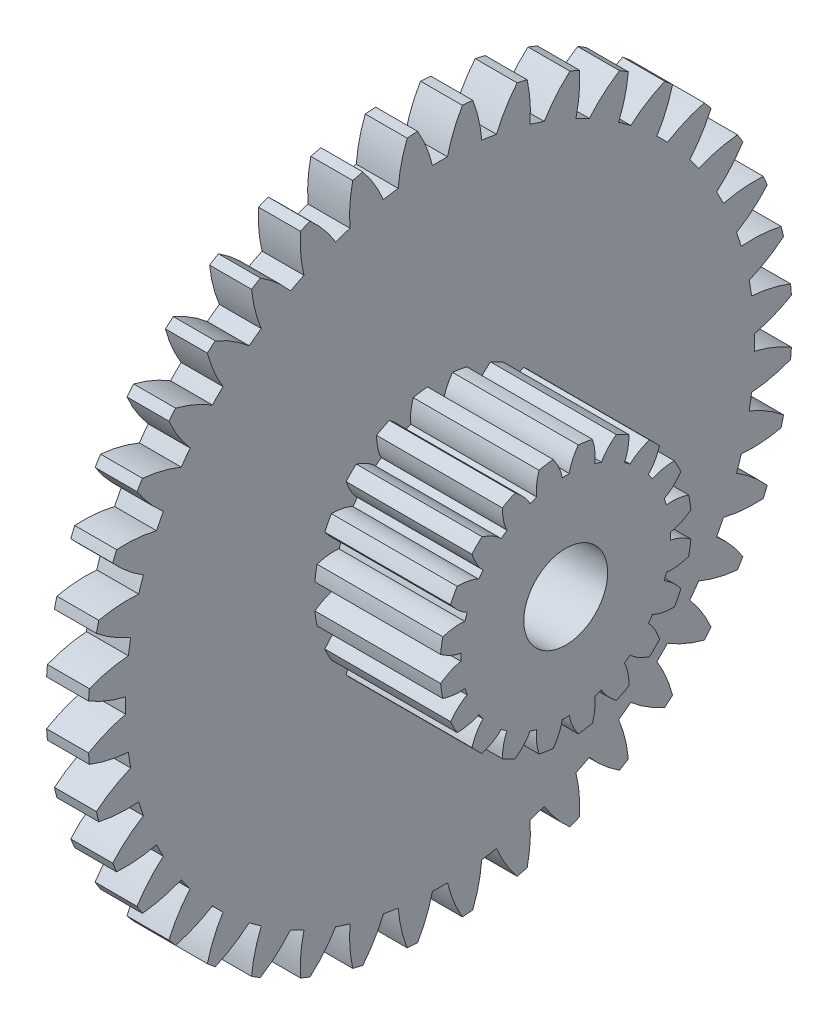
from build123d import *

# Parameters (mm, degrees)
BASPROSKE_W                  = 1
BASPROSKE_H                  = 8.4
TOOTHCUT_DEPTH               = 12.921409313
TEETHCUTS_COUNT              = 40
TEETHCUTS_ANGLE              = 351
BORSKE_R                     = 1
BORE_DEPTH                   = 50.0000508
ESTRUSIONE_ESTRUSIONE1_START = 4
SCHIZZO2_R                   = 3
SCHIZZO2_R_2                 = 1
ESTRUSIONE_ESTRUSIONE1_DEPTH = 3
TAGLIO_ESTRUSIONE1_DEPTH     = 3
RIPETIZIONECIRCOLARE1_COUNT  = 20


with BuildPart() as part:
    # BasProSke → Base-Revolve (revolve)
    with BuildSketch(Plane(origin=(0, 0, 0), x_dir=(1, 0, 0), z_dir=(0, 1, 0)), mode=Mode.PRIVATE) as base_revolve_sk:
        with Locations((0.5, 4.2)):
            Rectangle(BASPROSKE_W, BASPROSKE_H)
    revolve(base_revolve_sk.sketch.rotate(Axis((-10, 0, 0), (1, 0, 0)), 180), axis=Axis((-10, 0, 0), (1, 0, 0)))

    # TooCutSke → ToothCut (cut, through all)
    with BuildSketch(Plane(origin=(0, 0, 0), x_dir=(0, 0, -1), z_dir=(1, 0, 0))):
        with BuildLine():
            ThreePointArc((0.178999427, 7.496863358), (0, 7.499), (-0.178999427, 7.496863358))
            ThreePointArc((-0.178999427, 7.496863358), (-0.32947437, 7.966484127), (-0.550318757, 8.407408306))
            ThreePointArc((-0.550318757, 8.407408306), (0, 8.4254), (0.550318757, 8.407408306))
            ThreePointArc((0.550318757, 8.407408306), (0.32947437, 7.966484127), (0.178999427, 7.496863358))
        make_face()
    toothcut = extrude(amount=TOOTHCUT_DEPTH, mode=Mode.SUBTRACT)

    # TeethCuts: ToothCut ×40 about axis
    teethcuts_axis = Axis((-10, 0, 0), (1, 0, 0))
    for i in range(1, TEETHCUTS_COUNT):
        add(toothcut.rotate(teethcuts_axis, i * TEETHCUTS_ANGLE / (TEETHCUTS_COUNT - 1)), mode=Mode.SUBTRACT)

    # BorSke → Bore (cut, symmetric)
    with BuildSketch(Plane(origin=(0, 0, 0), x_dir=(0, 0, -1), z_dir=(1, 0, 0))):
        with Locations(Location((0, 0, 0), (0, 0, 180))):
            Circle(BORSKE_R)
    extrude(amount=BORE_DEPTH, both=True, mode=Mode.SUBTRACT)

    # Schizzo2 → Estrusione-Estrusione1 (add)
    with BuildSketch(Plane(origin=(0, 0, 0), x_dir=(0, 0, -1), z_dir=(1, 0, 0)).offset(ESTRUSIONE_ESTRUSIONE1_START)):
        with Locations(Location((0, 0, 0), (0, 0, 180))):
            Circle(SCHIZZO2_R)
        with Locations(Location((0, 0, 0), (0, 0, 180))):
            Circle(SCHIZZO2_R_2, mode=Mode.SUBTRACT)
    extrude(amount=-ESTRUSIONE_ESTRUSIONE1_DEPTH)

    # Schizzo3 → Taglio-Estrusione1 (cut)
    with BuildSketch(Plane(origin=(4, 0, 0), x_dir=(0, 0, -1), z_dir=(1, 0, 0))):
        with BuildLine():
            Line((3.705980677, -1.130007177), (3.705980677, 1.130007177))
            add(Edge.make_bspline(
                [(2.498477068, 0.087248742), (2.500908393, 0.087333645), (2.507719577, 0.087738474), (2.520556129, 0.08916161), (2.541393066, 0.092413679), (2.579819517, 0.100439305), (2.625301297, 0.113321891), (2.675840335, 0.131027061), (2.729176458, 0.153159367), (2.774103931, 0.173985465), (2.818233481, 0.196504546), (2.861534397, 0.220494376), (2.913145205, 0.251359557), (2.973821949, 0.290863056), (3.042822029, 0.340567013), (3.11868634, 0.401033622), (3.19323188, 0.466869136), (3.264234213, 0.535062906), (3.333076306, 0.607702814), (3.397614501, 0.680628046), (3.461453924, 0.759969037), (3.518769122, 0.835057499), (3.579246099, 0.922923208), (3.626975786, 0.994947889), (3.673040298, 1.072299166), (3.694976169, 1.110372929), (3.705980677, 1.130007177)],
                knots=[0, 0, 0, 0, 0, 0.005376748, 0.015083688, 0.02853182, 0.046610139, 0.092110525, 0.119476175, 0.146842495, 0.174208853, 0.201574955, 0.228941013, 0.256307345, 0.307035032, 0.361767351, 0.41649966, 0.471231936, 0.525964281, 0.580696615, 0.635428982, 0.690161387, 0.744893688, 0.799626083, 0.854358409, 0.909090916, 0.909090916, 0.909090916, 0.909090916, 0.909090916], degree=4))
            ThreePointArc((2.498477068, 0.087248742), (2.5, 0), (2.498477068, -0.087248742))
            add(Edge.make_bspline(
                [(2.498477068, -0.087248742), (2.500908393, -0.087333645), (2.507719577, -0.087738474), (2.520556129, -0.08916161), (2.541393066, -0.092413679), (2.579819517, -0.100439305), (2.625301297, -0.113321891), (2.675840335, -0.131027061), (2.729176458, -0.153159367), (2.774103931, -0.173985465), (2.818233481, -0.196504546), (2.861534397, -0.220494376), (2.913145205, -0.251359557), (2.973821949, -0.290863056), (3.042822029, -0.340567013), (3.11868634, -0.401033622), (3.19323188, -0.466869136), (3.264234213, -0.535062906), (3.333076306, -0.607702814), (3.397614501, -0.680628046), (3.461453924, -0.759969037), (3.518769122, -0.835057499), (3.579246099, -0.922923208), (3.626975786, -0.994947889), (3.673040298, -1.072299166), (3.694976169, -1.110372929), (3.705980677, -1.130007177)],
                knots=[0, 0, 0, 0, 0, 0.005376748, 0.015083688, 0.02853182, 0.046610139, 0.092110525, 0.119476175, 0.146842495, 0.174208853, 0.201574955, 0.228941013, 0.256307345, 0.307035032, 0.361767351, 0.41649966, 0.471231936, 0.525964281, 0.580696615, 0.635428982, 0.690161387, 0.744893688, 0.799626083, 0.854358409, 0.909090916, 0.909090916, 0.909090916, 0.909090916, 0.909090916], degree=4))
        make_face()
    taglio_estrusione1 = extrude(amount=-TAGLIO_ESTRUSIONE1_DEPTH, mode=Mode.SUBTRACT)

    # RipetizioneCircolare1: Taglio-Estrusione1 ×20 about axis
    ripetizionecircolare1_axis = Axis((50.0000508, 0, 0), (-1, 0, 0))
    for i in range(1, RIPETIZIONECIRCOLARE1_COUNT):
        add(taglio_estrusione1.rotate(ripetizionecircolare1_axis, i * 360 / RIPETIZIONECIRCOLARE1_COUNT), mode=Mode.SUBTRACT)


solid = part.part
